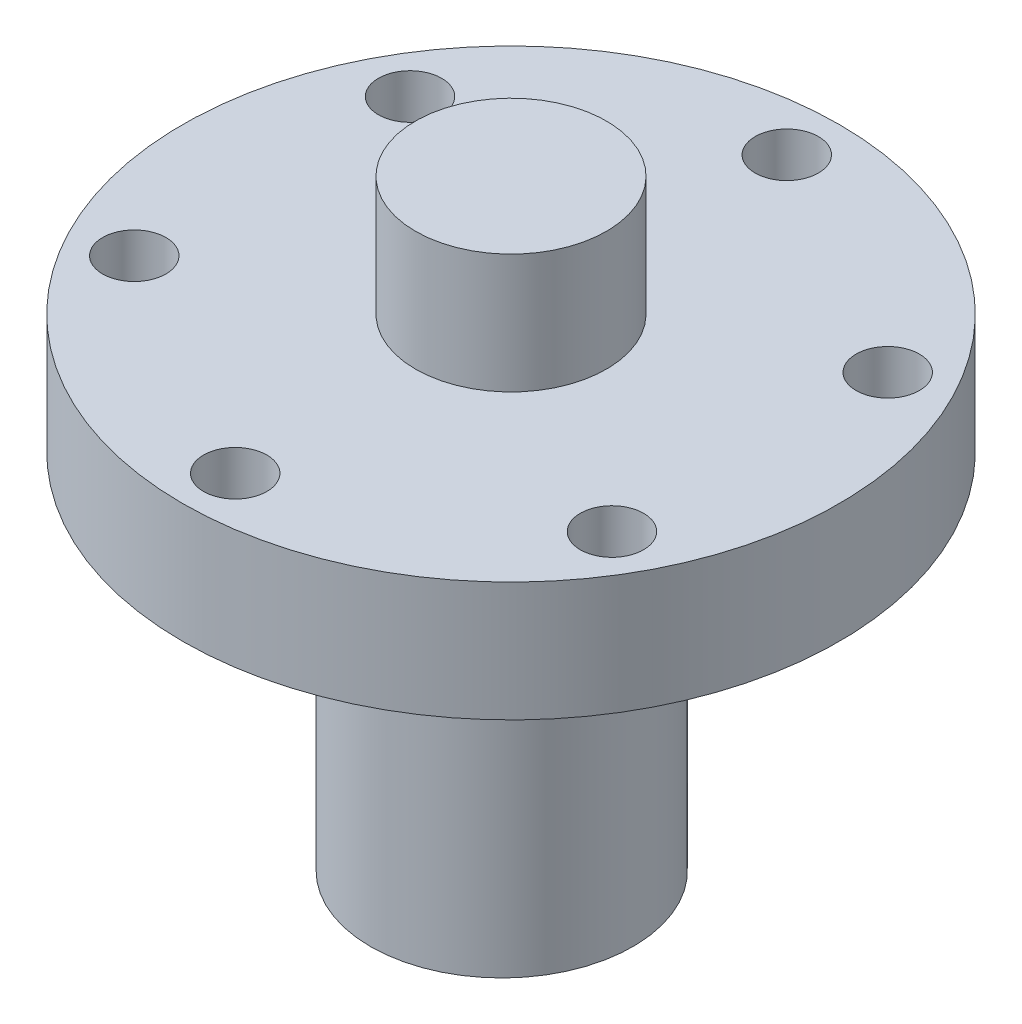
from build123d import *

# Parameters (mm, degrees)
SKETCH1_R           = 34.925
EXTRUDE1_DEPTH      = 12.7
SKETCH3_R           = 3.3655
CUT_EXTRUDE2_DEPTH  = 12.7
CIRPATTERN1_COUNT   = 6
SKETCH6_R           = 10.16
EXTRUDE2_DEPTH      = 12.7
SKETCH7_R           = 13.97
SKETCH7_R_2         = 12.7
EXTRUDE_THIN2_DEPTH = 38.1
SKETCH8_R           = 2.54
EXTRUDE4_DEPTH      = 38.1


with BuildPart() as part:
    # Sketch1 → Extrude1 (new body)
    with BuildSketch(Plane(origin=(0, 0, 0), x_dir=(1, 0, 0), z_dir=(0, 1, 0))):
        Circle(SKETCH1_R)
    extrude(amount=EXTRUDE1_DEPTH)

    # Sketch3 → Cut-Extrude2 (cut)
    with BuildSketch(Plane(origin=(0, 0, 0), x_dir=(1, 0, 0), z_dir=(0, 1, 0))):
        with Locations((0, 29.337)):
            Circle(SKETCH3_R)
    cut_extrude2 = extrude(amount=CUT_EXTRUDE2_DEPTH, mode=Mode.SUBTRACT)

    # CirPattern1: Cut-Extrude2 ×6 about axis
    cirpattern1_axis = Axis((0, 35.858162691, 0), (0, -1, 0))
    for i in range(1, CIRPATTERN1_COUNT):
        add(cut_extrude2.rotate(cirpattern1_axis, i * 360 / CIRPATTERN1_COUNT), mode=Mode.SUBTRACT)

    # Sketch6 → Extrude2 (add)
    with BuildSketch(Plane(origin=(0, 12.7, 0), x_dir=(-1, 0, 0), z_dir=(0, 1, 0))):
        Circle(SKETCH6_R)
    extrude(amount=EXTRUDE2_DEPTH)

    # Sketch7 → Extrude-Thin2 (add)
    with BuildSketch(Plane.XZ):
        with Locations((0, 0.982903874)):
            Circle(SKETCH7_R)
        with Locations((0, 0.982903874)):
            Circle(SKETCH7_R_2, mode=Mode.SUBTRACT)
    extrude(amount=EXTRUDE_THIN2_DEPTH)

    # Sketch8 → Extrude4 (add)
    with BuildSketch(Plane.XZ):
        Circle(SKETCH8_R)
    extrude(amount=EXTRUDE4_DEPTH)


solid = part.part
